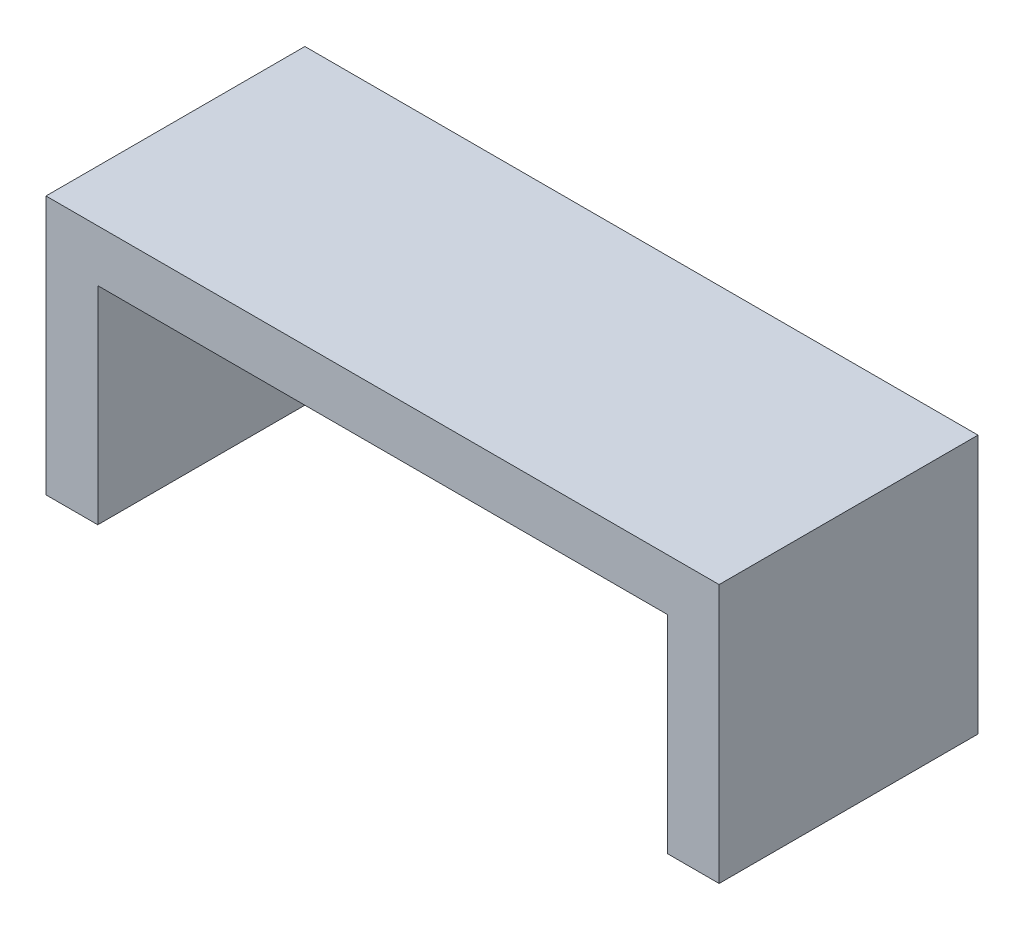
from build123d import *

# Parameters (mm, degrees)
SKETCH_1_W        = 5
SKETCH_1_H        = 25
EXTRUDE_1_DEPTH   = 20
EXTRUDE_1_2_DEPTH = 20
SKETCH_2_W        = 65
SKETCH_2_H        = 25
EXTRUDE_2_DEPTH   = 5


with BuildPart() as part:
    # ｽｹｯﾁ1 → ﾎﾞｽ - 押し出し1 (new body)
    with BuildSketch(Plane(origin=(0, 0, 0), x_dir=(1, 0, 0), z_dir=(0, 1, 0))):
        with Locations((30, 0)):
            Rectangle(SKETCH_1_W, SKETCH_1_H)
    extrude(amount=EXTRUDE_1_DEPTH)



with BuildPart() as body_2:
    # ｽｹｯﾁ1 → Extrude 1 2 (new body)
    with BuildSketch(Plane(origin=(0, 0, 0), x_dir=(1, 0, 0), z_dir=(0, 1, 0))):
        with Locations((-30, 0)):
            Rectangle(SKETCH_1_W, SKETCH_1_H)
    extrude(amount=EXTRUDE_1_2_DEPTH)


with BuildPart() as part_1:
    add(part.part)

    add(body_2.part)  # ﾎﾞｽ - 押し出し2 merges body 2
    # ｽｹｯﾁ2 → ﾎﾞｽ - 押し出し2 (add)
    with BuildSketch(Plane(origin=(0, 20, 0), x_dir=(1, 0, 0), z_dir=(0, 1, 0))):
        Rectangle(SKETCH_2_W, SKETCH_2_H)
    extrude(amount=EXTRUDE_2_DEPTH)


solid = part_1.part
